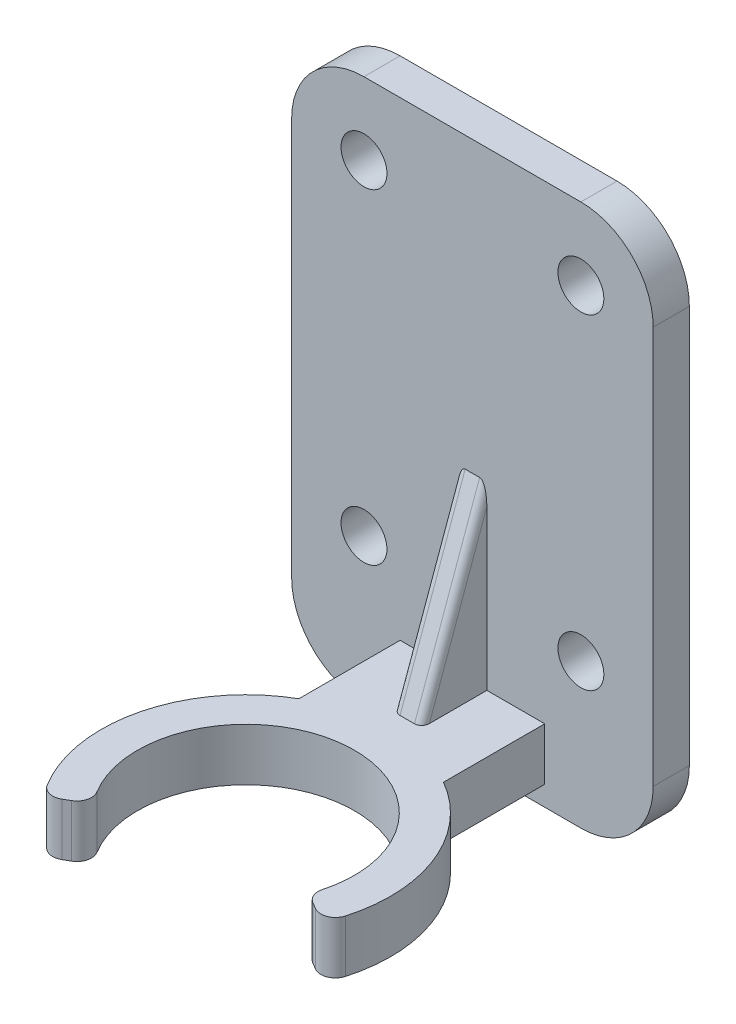
from build123d import *

# Parameters (mm, degrees)
BOSS_EXTRUDE1_DEPTH      = 10
SKETCH2_W                = 20
SKETCH2_H                = 10
BOSS_EXTRUDE2_DEPTH      = 10
BOSS_EXTRUDE3_DEPTH      = 5
BOSS_EXTRUDE4_DEPTH      = 2
BOSS_EXTRUDE4_DEPTH_BACK = 2
FILLET1_R                = 1
SKETCH6_R                = 3.175
CUT_EXTRUDE1_DEPTH       = 90.841967072
SKETCH8_W                = 55.480567722
SKETCH8_H                = 48.561795017
CUT_EXTRUDE2_DEPTH       = 2.75


with BuildPart() as part:
    # Sketch1 → Boss-Extrude1 (new body)
    with BuildSketch(Plane(origin=(0, 0, 0), x_dir=(1, 0, 0), z_dir=(0, 1, 0))):
        with BuildLine():
            Line((-13.509053295, -10.59136074), (-14.375325888, -11.091503454))
            ThreePointArc((-14.375325888, -11.091503454), (-15.870504116, -11.297182897), (-17.083695431, -10.39939183))
            ThreePointArc((-17.083695431, -10.39939183), (-19.377302502, 4.951782281), (-10, 17.320508076))
            Line((-10, 17.320508076), (-10, 21.320508076))
            Line((-10, 21.320508076), (2.687202796, 21.320508076))
            Line((2.687202796, 21.320508076), (10, 21.320508076))
            Line((10, 21.320508076), (10, 17.320508076))
            ThreePointArc((10, 17.320508076), (18.538798966, 7.504194355), (19.232390566, -5.487727502))
            ThreePointArc((19.232390566, -5.487727502), (18.059570944, -6.792834648), (16.309151509, -6.671005559))
            Line((16.309151509, -6.671005559), (15.414666731, -6.154574532))
            ThreePointArc((15.414666731, -6.154574532), (14.566381317, -5.186618632), (14.483529469, -3.902226816))
            ThreePointArc((14.483529469, -3.902226816), (-2.130312968, 14.847954965), (-12.802105849, -7.817038176))
            ThreePointArc((-12.802105849, -7.817038176), (-12.570985303, -9.353164625), (-13.509053295, -10.59136074))
        make_face()
    extrude(amount=BOSS_EXTRUDE1_DEPTH)

    # Sketch2 → Boss-Extrude2 (add)
    with BuildSketch(Plane(origin=(0, 0, -21.320508076), x_dir=(-1, 0, 0), z_dir=(0, 0, -1))):
        with Locations((0, 5)):
            Rectangle(SKETCH2_W, SKETCH2_H)
    extrude(amount=BOSS_EXTRUDE2_DEPTH)

    # Sketch3 → Boss-Extrude3 (add)
    with BuildSketch(Plane(origin=(0, 0, -31.320508076), x_dir=(-1, 0, 0), z_dir=(0, 0, -1))):
        with BuildLine():
            Line((-15, 75), (15, 75))
            ThreePointArc((15, 75), (22.071067812, 72.071067812), (25, 65))
            Line((25, 65), (25, 10))
            ThreePointArc((25, 10), (22.071067812, 2.928932188), (15, 0))
            Line((15, 0), (-15, 0))
            ThreePointArc((-15, 0), (-22.071067812, 2.928932188), (-25, 10))
            Line((-25, 10), (-25, 65))
            ThreePointArc((-25, 65), (-22.071067812, 72.071067812), (-15, 75))
        make_face()
    extrude(amount=BOSS_EXTRUDE3_DEPTH)

    # Sketch4 → Boss-Extrude4 (add, two sides: drawn at the far end of the back side and taken through both)
    with BuildSketch(Plane.ZY.offset(-BOSS_EXTRUDE4_DEPTH_BACK)):
        Polygon((-22.311101636, 10), (-31.320508076, 35), (-31.320508076, 10), align=None)
    extrude(amount=BOSS_EXTRUDE4_DEPTH + BOSS_EXTRUDE4_DEPTH_BACK)

    # Fillet1
    fillet1_edges = [part.edges().sort_by_distance(p)[0] for p in [
        (2, 22.5, -26.815804856),
        (-2, 22.5, -26.815804856),
    ]]
    fillet(fillet1_edges, radius=FILLET1_R)

    # Sketch6 → Cut-Extrude1 (cut, through all)
    with BuildSketch(Plane.XY.offset(-31.320508076)):
        with Locations((-15, 65)):
            Circle(SKETCH6_R)
        with Locations((15, 65)):
            Circle(SKETCH6_R)
        with Locations((15, 20)):
            Circle(SKETCH6_R)
        with Locations((-15, 20)):
            Circle(SKETCH6_R)
    extrude(amount=-CUT_EXTRUDE1_DEPTH, mode=Mode.SUBTRACT)

    # Sketch8 → Cut-Extrude2 (cut)
    with BuildSketch(Plane.XZ):
        with Locations((-0.773192615, -7.039610568)):
            Rectangle(SKETCH8_W, SKETCH8_H)
    extrude(amount=-CUT_EXTRUDE2_DEPTH, mode=Mode.SUBTRACT)


solid = part.part
